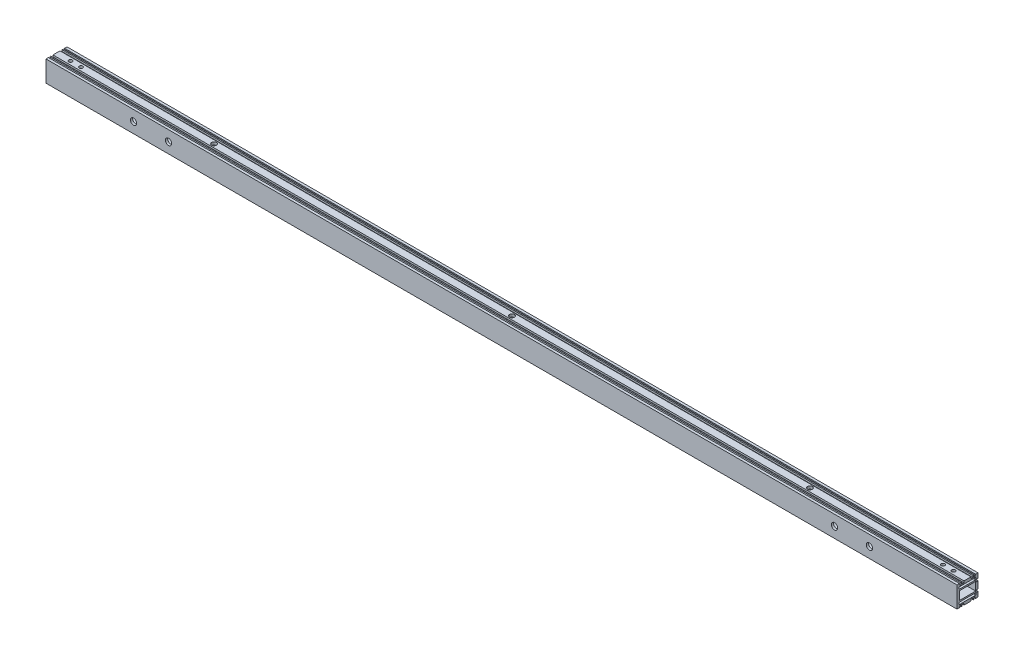
from build123d import *

# Parameters (mm, degrees)
SKETCH_1_W                = 23.5
SKETCH_1_H                = 12
EXTRUDE_1_DEPTH           = 650.5
HOLE_WIZARD_M6_1_D        = 5
HOLE_WIZARD_M6_1_DEPTH    = 19
HOLE_WIZARD_M6_1_TIP      = 1.502151548
HOLE_WIZARD_M6_2_D        = 5
HOLE_WIZARD_M6_2_DEPTH    = 19
HOLE_WIZARD_M6_2_TIP      = 1.502151548
HOLE_WIZARD_9_0_9_1_D     = 9
HOLE_WIZARD_M6_3_D        = 5
HOLE_WIZARD_M6_3_DEPTH    = 15
HOLE_WIZARD_M6_3_TIP      = 1.502151548
HOLE_WIZARD_7_0_7_1_D     = 7
HOLE_WIZARD_7_0_7_1_DEPTH = 15
HOLE_WIZARD_7_0_7_1_TIP   = 2.103012167


with BuildPart() as part:
    # 草图1 → 凸台-拉伸1 (new, symmetric)
    with BuildSketch(Plane(origin=(0, 0, 0), x_dir=(0, 0, -1), z_dir=(1, 0, 0))):
        Polygon((-15, 15), (-11.5, 15), (-11.5, 13.5), (-11, 13.5), (-11, 12), (-9.5, 12), (-9.5, 15), (-8, 15), (-8, 12.5), (-5, 12.5), (-5, 15), (5, 15), (5, 12.5), (8, 12.5), (8, 15), (9.5, 15), (9.5, 12), (11, 12), (11, 13.5), (11.5, 13.5), (11.5, 15), (15, 15), (15, 8), (12.5, 8), (12.5, 5), (15, 5), (15, -5), (12.5, -5), (12.5, -8), (15, -8), (15, -15), (11.5, -15), (11.5, -13.5), (11, -13.5), (11, -12), (9.5, -12), (9.5, -15), (8, -15), (8, -12.5), (5, -12.5), (5, -15), (-5, -15), (-5, -12.5), (-8, -12.5), (-8, -15), (-9.5, -15), (-9.5, -12), (-11, -12), (-11, -13.5), (-11.5, -13.5), (-11.5, -15), (-15, -15), align=None)
        with BuildLine():
            Line((12, -10.5), (12, -8.5))
            ThreePointArc((12, -8.5), (11.853553391, -8.146446609), (11.5, -8))
            Line((11.5, -8), (-11.5, -8))
            ThreePointArc((-11.5, -8), (-11.853553391, -8.146446609), (-12, -8.5))
            Line((-12, -8.5), (-12, -10.5))
            ThreePointArc((-12, -10.5), (-11.853553391, -10.853553391), (-11.5, -11))
            Line((-11.5, -11), (11.5, -11))
            ThreePointArc((11.5, -11), (11.853553391, -10.853553391), (12, -10.5))
        make_face(mode=Mode.SUBTRACT)
        with BuildLine():
            Line((-11.5, 11), (11.5, 11))
            ThreePointArc((11.5, 11), (11.853553391, 10.853553391), (12, 10.5))
            Line((12, 10.5), (12, 8.5))
            ThreePointArc((12, 8.5), (11.853553391, 8.146446609), (11.5, 8))
            Line((11.5, 8), (-11.5, 8))
            ThreePointArc((-11.5, 8), (-11.853553391, 8.146446609), (-12, 8.5))
            Line((-12, 8.5), (-12, 10.5))
            ThreePointArc((-12, 10.5), (-11.853553391, 10.853553391), (-11.5, 11))
        make_face(mode=Mode.SUBTRACT)
        Rectangle(SKETCH_1_W, SKETCH_1_H, mode=Mode.SUBTRACT)
    extrude(amount=EXTRUDE_1_DEPTH, both=True)

    # M6 螺纹孔1
    with Locations(Plane(origin=(0, 0, -15), x_dir=(-1, 0, 0), z_dir=(0, 0, -1))):
        with Locations((-615.5, 0), (-630.5, 0), (630.5, 0), (615.5, 0)):
            Hole(HOLE_WIZARD_M6_1_D / 2, depth=HOLE_WIZARD_M6_1_DEPTH)
            with Locations((0, 0, -(HOLE_WIZARD_M6_1_DEPTH + HOLE_WIZARD_M6_1_TIP / 2))):  # 118° drill point
                Cone(0, HOLE_WIZARD_M6_1_D / 2, HOLE_WIZARD_M6_1_TIP, mode=Mode.SUBTRACT)

    # M6 螺纹孔2
    with Locations(Plane(origin=(0, 15, 0), x_dir=(1, 0, 0), z_dir=(0, 1, 0))):
        with Locations((630.5, 0), (615.5, 0), (-630.5, 0), (-615.5, 0)):
            Hole(HOLE_WIZARD_M6_2_D / 2, depth=HOLE_WIZARD_M6_2_DEPTH)
            with Locations((0, 0, -(HOLE_WIZARD_M6_2_DEPTH + HOLE_WIZARD_M6_2_TIP / 2))):  # 118° drill point
                Cone(0, HOLE_WIZARD_M6_2_D / 2, HOLE_WIZARD_M6_2_TIP, mode=Mode.SUBTRACT)

    # Ø9.0 (9) 直径孔1 (through all)
    with Locations(Plane(origin=(0, 0, -15), x_dir=(-1, 0, 0), z_dir=(0, 0, -1))):
        with Locations((-525.5, 0), (-475.5, 0), (475.5, 0), (525.5, 0)):
            Hole(HOLE_WIZARD_9_0_9_1_D / 2)

    # M6 螺纹孔3
    with Locations(Plane(origin=(0, -15, 0), x_dir=(-1, 0, 0), z_dir=(0, -1, 0))):
        with Locations((-425.5, 0), (0, 0), (425.5, 0)):
            Hole(HOLE_WIZARD_M6_3_D / 2, depth=HOLE_WIZARD_M6_3_DEPTH)
            with Locations((0, 0, -(HOLE_WIZARD_M6_3_DEPTH + HOLE_WIZARD_M6_3_TIP / 2))):  # 118° drill point
                Cone(0, HOLE_WIZARD_M6_3_D / 2, HOLE_WIZARD_M6_3_TIP, mode=Mode.SUBTRACT)

    # Ø7.0 (7) 直径孔1
    with Locations(Plane(origin=(0, 15, 0), x_dir=(1, 0, 0), z_dir=(0, 1, 0))):
        with Locations((-425.5, 0), (0, 0), (425.5, 0)):
            Hole(HOLE_WIZARD_7_0_7_1_D / 2, depth=HOLE_WIZARD_7_0_7_1_DEPTH)
            with Locations((0, 0, -(HOLE_WIZARD_7_0_7_1_DEPTH + HOLE_WIZARD_7_0_7_1_TIP / 2))):  # 118° drill point
                Cone(0, HOLE_WIZARD_7_0_7_1_D / 2, HOLE_WIZARD_7_0_7_1_TIP, mode=Mode.SUBTRACT)


solid = part.part
